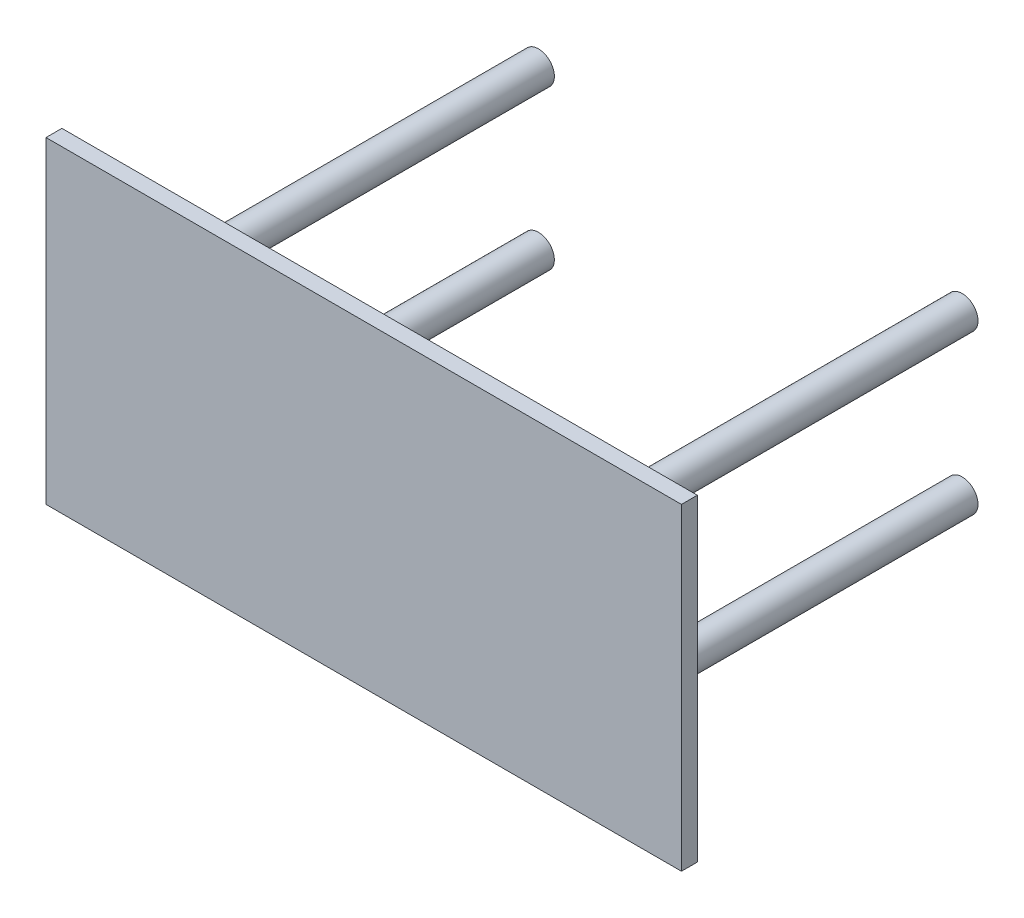
from build123d import *

# Parameters (mm, degrees)
SKETCH_1_W      = 120
SKETCH_1_H      = 60
EXTRUDE_1_DEPTH = 3
SKETCH_2_R      = 3
EXTRUDE_2_DEPTH = 70


with BuildPart() as part:
    # 草图1 → 凸台-拉伸1 (new body)
    with BuildSketch(Plane.XY):
        Rectangle(SKETCH_1_W, SKETCH_1_H)
    extrude(amount=EXTRUDE_1_DEPTH)

    # 草图2 → 凸台-拉伸2 (add)
    with BuildSketch(Plane(origin=(0, 0, 0), x_dir=(-1, 0, 0), z_dir=(0, 0, -1))):
        with Locations((-40, 15)):
            Circle(SKETCH_2_R)
        with Locations(Location((40, 15, 0), (0, 0, 180))):
            Circle(SKETCH_2_R)
        with Locations((40, -15)):
            Circle(SKETCH_2_R)
        with Locations(Location((-40, -15, 0), (0, 0, 180))):
            Circle(SKETCH_2_R)
    extrude(amount=EXTRUDE_2_DEPTH)


solid = part.part
